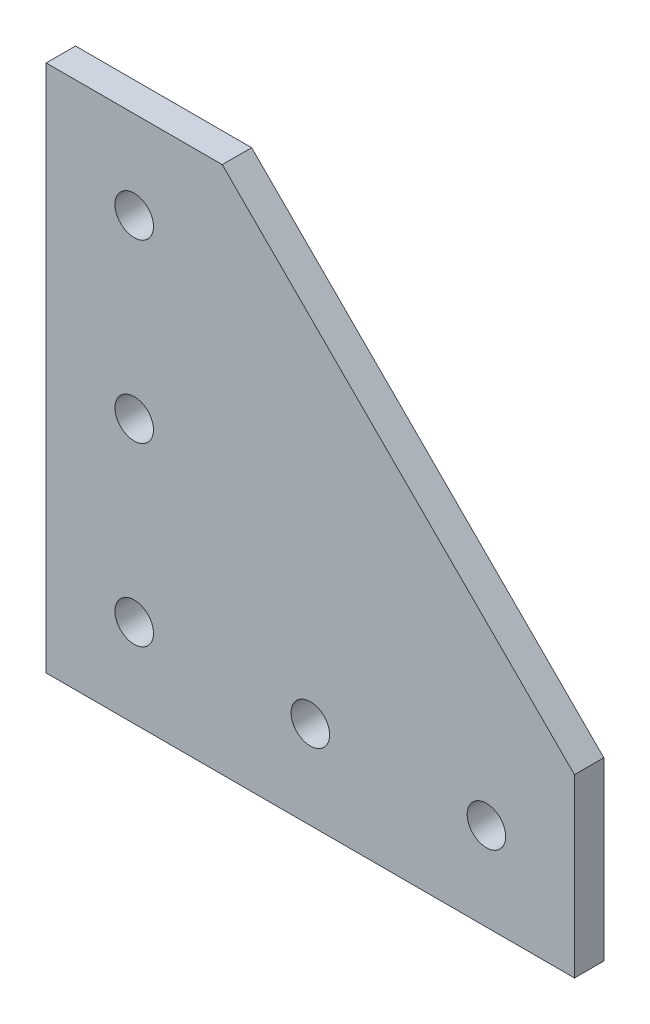
from build123d import *

# Parameters (mm, degrees)
SKETCH1_R           = 4.1656
BOSS_EXTRUDE1_DEPTH = 3.175


with BuildPart() as part:
    # Sketch1 → Boss-Extrude1 (new, symmetric)
    with BuildSketch(Plane.XY):
        Polygon((0, 0), (0, 114.3), (38.1, 114.3), (114.3, 38.1), (114.3, 0), align=None)
        with Locations((19.05, 19.05)):
            Circle(SKETCH1_R, mode=Mode.SUBTRACT)
        with Locations((57.15, 19.05)):
            Circle(SKETCH1_R, mode=Mode.SUBTRACT)
        with Locations((95.25, 19.05)):
            Circle(SKETCH1_R, mode=Mode.SUBTRACT)
        with Locations((19.05, 57.15)):
            Circle(SKETCH1_R, mode=Mode.SUBTRACT)
        with Locations((19.05, 95.25)):
            Circle(SKETCH1_R, mode=Mode.SUBTRACT)
    extrude(amount=BOSS_EXTRUDE1_DEPTH, both=True)


solid = part.part
